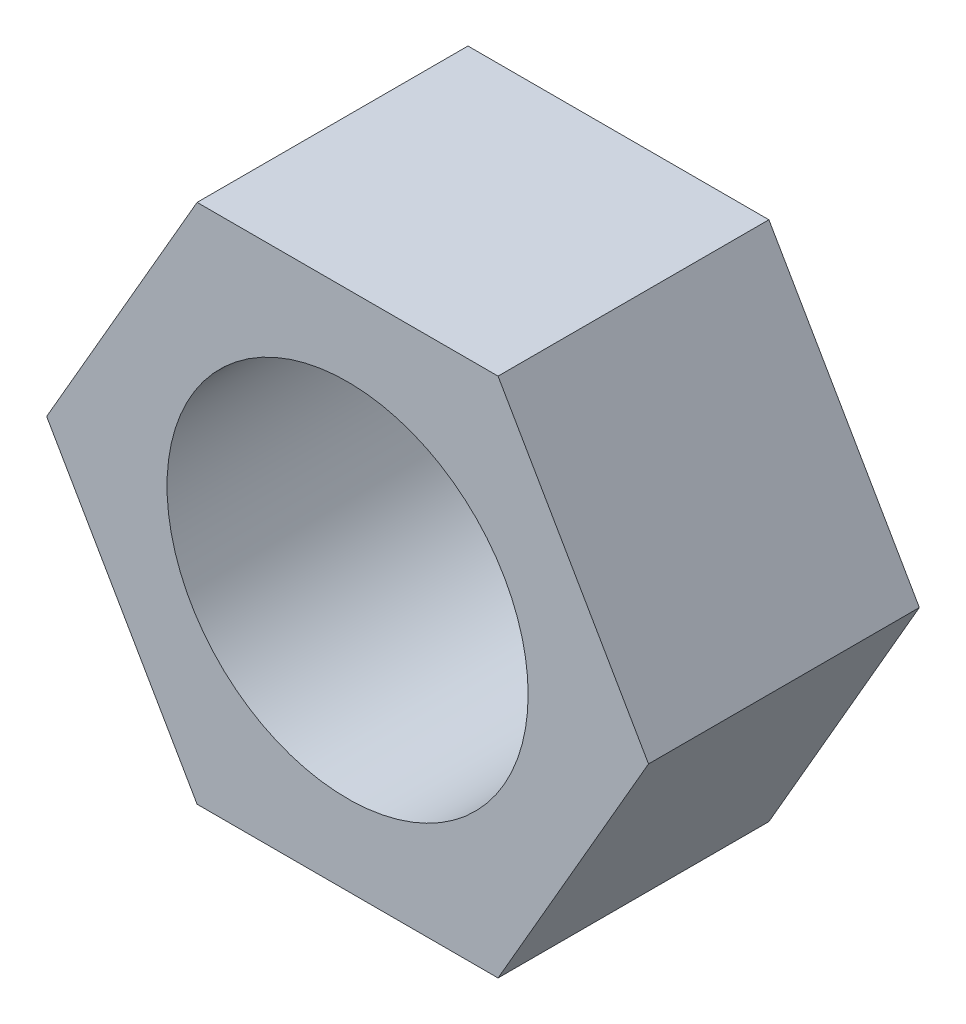
from build123d import *

# Parameters (mm, degrees)
SKETCH1_R           = 12
BOSS_EXTRUDE1_DEPTH = 9


with BuildPart() as part:
    # Sketch1 → Boss-Extrude1 (new, symmetric)
    with BuildSketch(Plane.XY):
        Polygon((10, 17.320508076), (-10, 17.320508076), (-20, 0), (-10, -17.320508076), (10, -17.320508076), (20, 0), align=None)
        Circle(SKETCH1_R, mode=Mode.SUBTRACT)
    extrude(amount=BOSS_EXTRUDE1_DEPTH, both=True)


solid = part.part
